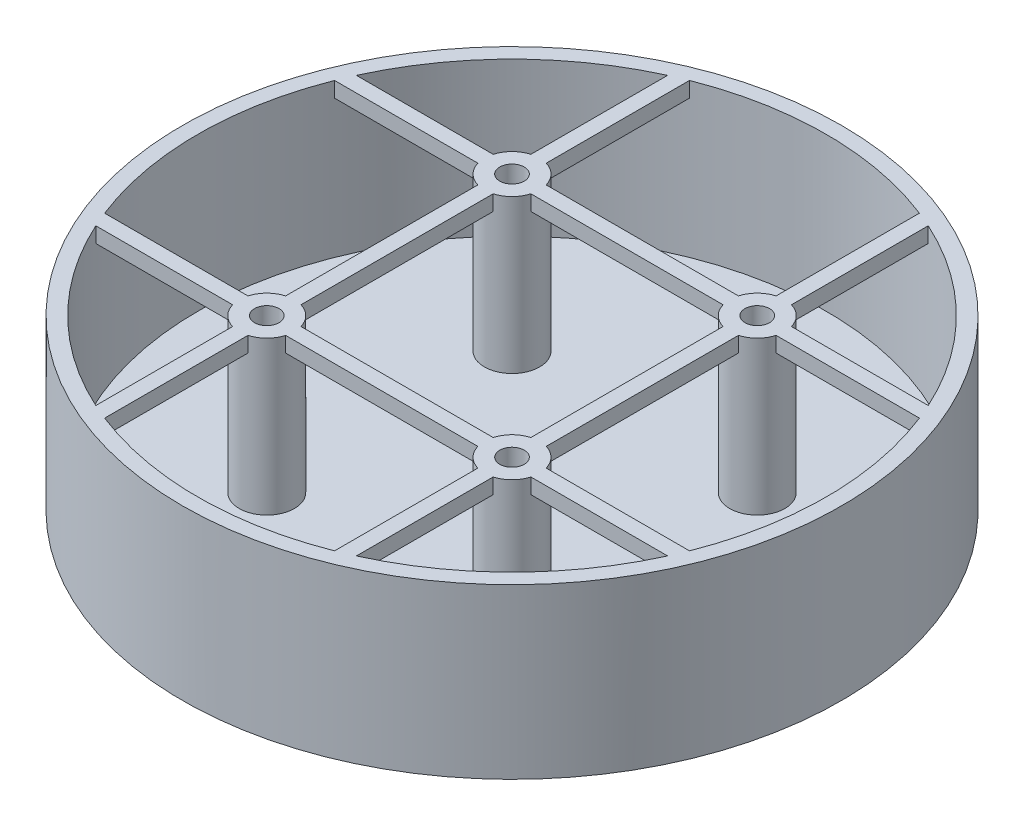
from build123d import *
from build123d.topology import SkipClean

# Parameters (mm, degrees)
SKETCH1_R           = 53.75
SKETCH1_R_2         = 51.25
BOSS_EXTRUDE1_DEPTH = 25
BOSS_EXTRUDE2_START = 2.5
SKETCH6_R           = 53.75
BOSS_EXTRUDE2_DEPTH = 2.5
SKETCH8_R           = 4.5
SKETCH8_R_2         = 2
BOSS_EXTRUDE3_DEPTH = 25
BOSS_EXTRUDE4_START = -2.5
BOSS_EXTRUDE4_DEPTH = 2.5


with BuildPart() as part:
    # Sketch1 → Boss-Extrude1 (new body)
    with BuildSketch(Plane(origin=(0, 0, 0), x_dir=(1, 0, 0), z_dir=(0, 1, 0))):
        with Locations(Location((0, 0, 0), (0, 0, 270))):
            Circle(SKETCH1_R)
        with Locations(Location((0, 0, 0), (0, 0, 270))):
            Circle(SKETCH1_R_2, mode=Mode.SUBTRACT)
    extrude(amount=BOSS_EXTRUDE1_DEPTH)

    # Sketch6 → Boss-Extrude2 (add)
    with BuildSketch(Plane.XZ.offset(BOSS_EXTRUDE2_START)):
        with Locations(Location((0, 0, 0), (0, 0, 270))):
            Circle(SKETCH6_R)
    extrude(amount=-BOSS_EXTRUDE2_DEPTH)

    # Sketch8 → Boss-Extrude3 (add)
    # profile 1 of 4: a face of its own
    with BuildSketch(Plane(origin=(0, 0, 0), x_dir=(1, 0, 0), z_dir=(0, 1, 0))):
        with Locations(Location((-20, 20, 0), (0, 0, 90))):
            Circle(SKETCH8_R)
        with Locations(Location((-20, 20, 0), (0, 0, 270))):
            Circle(SKETCH8_R_2, mode=Mode.SUBTRACT)
    # profile 2 of 4: a face of its own
    with BuildSketch(Plane(origin=(0, 0, 0), x_dir=(1, 0, 0), z_dir=(0, 1, 0))):
        with Locations(Location((20, 20, 0), (0, 0, 90))):
            Circle(SKETCH8_R)
        with Locations(Location((20, 20, 0), (0, 0, 270))):
            Circle(SKETCH8_R_2, mode=Mode.SUBTRACT)
    # profile 3 of 4: a face of its own
    with BuildSketch(Plane(origin=(0, 0, 0), x_dir=(1, 0, 0), z_dir=(0, 1, 0))):
        with Locations(Location((20, -20, 0), (0, 0, 90))):
            Circle(SKETCH8_R)
        with Locations(Location((20, -20, 0), (0, 0, 270))):
            Circle(SKETCH8_R_2, mode=Mode.SUBTRACT)
    # profile 4 of 4: a face of its own
    with BuildSketch(Plane(origin=(0, 0, 0), x_dir=(1, 0, 0), z_dir=(0, 1, 0))):
        with Locations(Location((-20, -20, 0), (0, 0, 90))):
            Circle(SKETCH8_R)
        with Locations(Location((-20, -20, 0), (0, 0, 270))):
            Circle(SKETCH8_R_2, mode=Mode.SUBTRACT)
    extrude(amount=BOSS_EXTRUDE3_DEPTH)

    # Sketch12 → Boss-Extrude4 (add)
    with SkipClean():  # the faces are left unmerged after this step: merging them gives an invalid solid
        with BuildSketch(Plane(origin=(0, 25, 0), x_dir=(1, 0, 0), z_dir=(0, 1, 0)).offset(BOSS_EXTRUDE4_START)):
            with BuildLine():
                Line((-18.75, 18.4387505), (-18.75, -18.4387505))
                ThreePointArc((-18.75, -18.4387505), (-20, -18), (-21.25, -18.4387505))
                Line((-21.25, -18.4387505), (-21.25, 18.4387505))
                ThreePointArc((-21.25, 18.4387505), (-20, 18), (-18.75, 18.4387505))
            make_face()
            with BuildLine():
                Line((18.4387505, 21.25), (-18.4387505, 21.25))
                ThreePointArc((-18.4387505, 21.25), (-18, 20), (-18.4387505, 18.75))
                Line((-18.4387505, 18.75), (18.4387505, 18.75))
                ThreePointArc((18.4387505, 18.75), (18, 20), (18.4387505, 21.25))
            make_face()
            with BuildLine():
                Line((21.25, 18.4387505), (21.25, -18.4387505))
                ThreePointArc((21.25, -18.4387505), (20, -18), (18.75, -18.4387505))
                Line((18.75, -18.4387505), (18.75, 18.4387505))
                ThreePointArc((18.75, 18.4387505), (20, 18), (21.25, 18.4387505))
            make_face()
            with BuildLine():
                Line((18.4387505, -21.25), (-18.4387505, -21.25))
                ThreePointArc((-18.4387505, -21.25), (-18, -20), (-18.4387505, -18.75))
                Line((-18.4387505, -18.75), (18.4387505, -18.75))
                ThreePointArc((18.4387505, -18.75), (18, -20), (18.4387505, -21.25))
            make_face()
            with BuildLine():
                Line((-21.5612495, 21.25), (-49.371044145, 21.25))
                ThreePointArc((-49.371044145, 21.25), (-49.887986714, 20.006281055), (-50.373604199, 18.75))
                Line((-50.373604199, 18.75), (-21.5612495, 18.75))
                ThreePointArc((-21.5612495, 18.75), (-22, 20), (-21.5612495, 21.25))
            make_face()
            with BuildLine():
                Line((-21.25, 21.5612495), (-21.25, 49.371044145))
                ThreePointArc((-21.25, 49.371044145), (-20.006281055, 49.887986714), (-18.75, 50.373604199))
                Line((-18.75, 50.373604199), (-18.75, 21.5612495))
                ThreePointArc((-18.75, 21.5612495), (-20, 22), (-21.25, 21.5612495))
            make_face()
            with BuildLine():
                Line((18.75, 21.5612495), (18.75, 50.373604199))
                ThreePointArc((18.75, 50.373604199), (20.006281055, 49.887986714), (21.25, 49.371044145))
                Line((21.25, 49.371044145), (21.25, 21.5612495))
                ThreePointArc((21.25, 21.5612495), (20, 22), (18.75, 21.5612495))
            make_face()
            with BuildLine():
                Line((21.5612495, 21.25), (49.371044145, 21.25))
                ThreePointArc((49.371044145, 21.25), (49.887986714, 20.006281055), (50.373604199, 18.75))
                Line((50.373604199, 18.75), (21.5612495, 18.75))
                ThreePointArc((21.5612495, 18.75), (22, 20), (21.5612495, 21.25))
            make_face()
            with BuildLine():
                Line((18.75, -21.5612495), (18.75, -50.373604199))
                ThreePointArc((18.75, -50.373604199), (20.006281055, -49.887986714), (21.25, -49.371044145))
                Line((21.25, -49.371044145), (21.25, -21.5612495))
                ThreePointArc((21.25, -21.5612495), (20, -22), (18.75, -21.5612495))
            make_face()
            with BuildLine():
                Line((21.5612495, -21.25), (49.371044145, -21.25))
                ThreePointArc((49.371044145, -21.25), (49.887986714, -20.006281055), (50.373604199, -18.75))
                Line((50.373604199, -18.75), (21.5612495, -18.75))
                ThreePointArc((21.5612495, -18.75), (22, -20), (21.5612495, -21.25))
            make_face()
            with BuildLine():
                Line((-18.75, -21.5612495), (-18.75, -50.373604199))
                ThreePointArc((-18.75, -50.373604199), (-20.006281055, -49.887986714), (-21.25, -49.371044145))
                Line((-21.25, -49.371044145), (-21.25, -21.5612495))
                ThreePointArc((-21.25, -21.5612495), (-20, -22), (-18.75, -21.5612495))
            make_face()
            with BuildLine():
                Line((-21.5612495, -21.25), (-49.371044145, -21.25))
                ThreePointArc((-49.371044145, -21.25), (-49.887986714, -20.006281055), (-50.373604199, -18.75))
                Line((-50.373604199, -18.75), (-21.5612495, -18.75))
                ThreePointArc((-21.5612495, -18.75), (-22, -20), (-21.5612495, -21.25))
            make_face()
        extrude(amount=BOSS_EXTRUDE4_DEPTH)


solid = part.part
